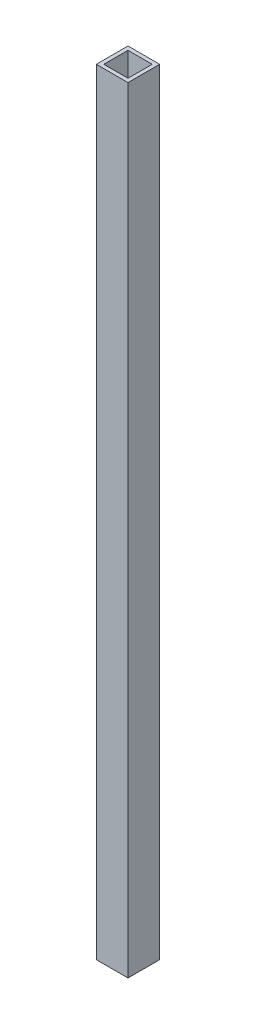
from build123d import *

# Parameters (mm, degrees)
SKETCH1_W           = 8.5
SKETCH1_H           = 8.5
SKETCH1_W_2         = 6.5
SKETCH1_H_2         = 6.5
BOSS_EXTRUDE1_DEPTH = 208.245


with BuildPart() as part:
    # Sketch1 → Boss-Extrude1 (new body)
    with BuildSketch(Plane(origin=(0, 0, 0), x_dir=(1, 0, 0), z_dir=(0, 1, 0))):
        with Locations((20.126704545, 26.085227273)):
            Rectangle(SKETCH1_W, SKETCH1_H)
        with Locations((20.126704545, 26.085227273)):
            Rectangle(SKETCH1_W_2, SKETCH1_H_2, mode=Mode.SUBTRACT)
    extrude(amount=BOSS_EXTRUDE1_DEPTH)


solid = part.part
